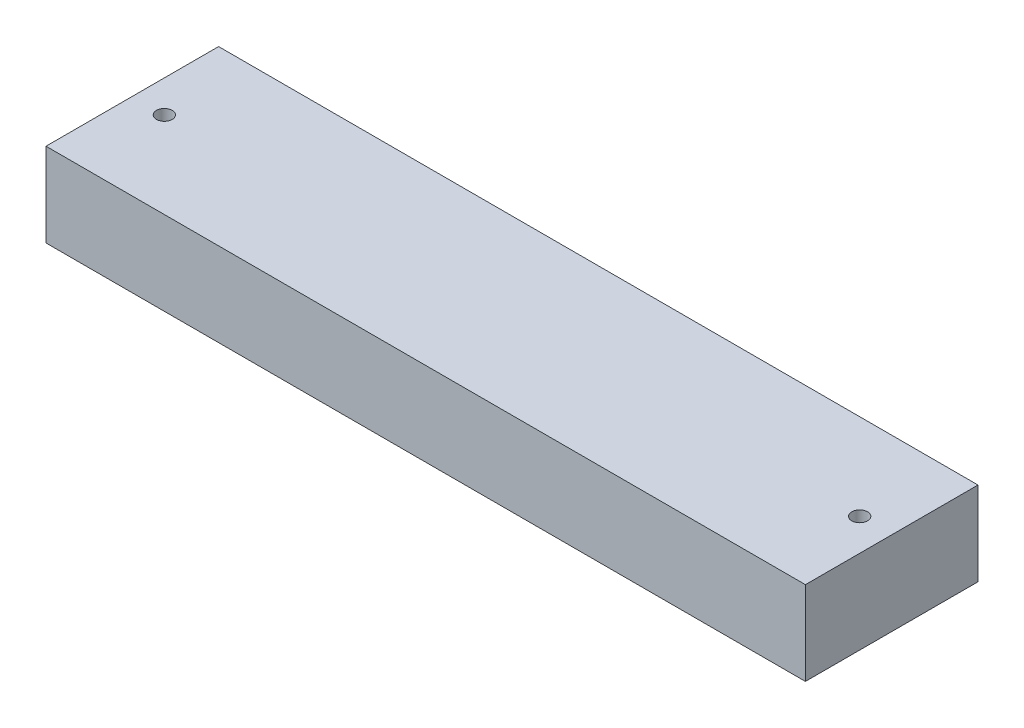
from build123d import *

# Parameters (mm, degrees)
SKETCH1_W            = 154
SKETCH1_H            = 35
BOSS_EXTRUDE1_DEPTH  = 17
M3_CLEARANCE_HOLE1_D = 3.2


with BuildPart() as part:
    # Sketch1 → Boss-Extrude1 (new body)
    with BuildSketch(Plane(origin=(0, 0, 0), x_dir=(1, 0, 0), z_dir=(0, 1, 0))):
        Rectangle(SKETCH1_W, SKETCH1_H)
    extrude(amount=BOSS_EXTRUDE1_DEPTH)

    # M3 Clearance Hole1 (through all)
    with Locations(Plane(origin=(0, 17, 0), x_dir=(1, 0, 0), z_dir=(0, 1, 0))):
        with Locations((-70.5, 0), (70.5, 0)):
            Hole(M3_CLEARANCE_HOLE1_D / 2)


solid = part.part
